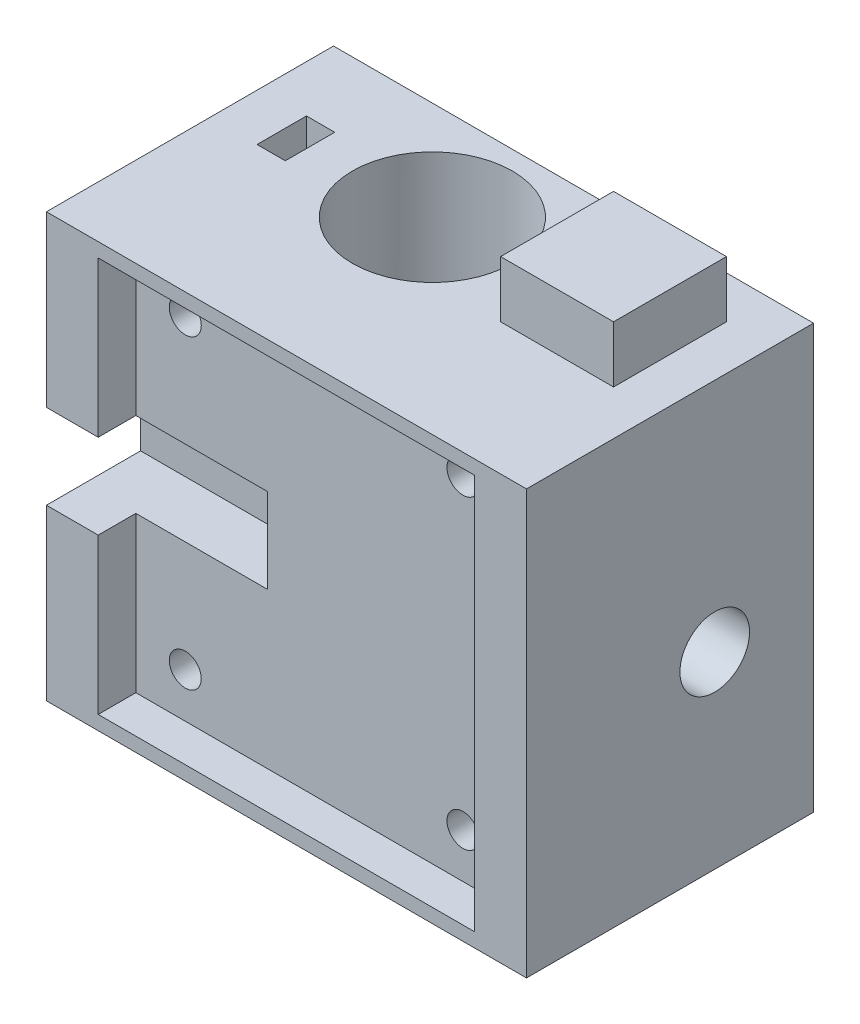
from build123d import *

# Parameters (mm, degrees)
BASE_R                        = 10.5
CUTLURE_TUBE_HOUSING_DEPTH    = 45
SKETCH1_W                     = 51
SKETCH1_H                     = 30.5
DETECTOR_LASER_HOUSING_DEPTH  = 45
CULTURE_SLOT_R                = 8.5
CULTURE_TUBE_SLOT_DEPTH       = 40
LASER_PORT_DEPTH              = 58.662812973
LASER_PORT_DEPTH_BACK         = 16
SKETCH3_R                     = 3.7
CUT_EXTRUDE3_REACH            = 59.663
CUT_EXTRUDE3_END_RADIUS       = 3.7
SKETCH4_W                     = 3
SKETCH4_H                     = 5.25
LED_DISPLAY_SCREW_HOLES_D     = 3.4
LED_DISPLAY_SCREW_HOLES_DEPTH = 20
SKETCH14_W                    = 40
SKETCH14_H                    = 42
CUT_EXTRUDE4_DEPTH            = 4
SKETCH16_W                    = 19.5
SKETCH16_H                    = 9
CUT_EXTRUDE6_DEPTH            = 10
SKETCH17_W                    = 12
SKETCH17_H                    = 12
BOSS_EXTRUDE3_DEPTH           = 6


with BuildPart() as part:
    # Base → Cutlure Tube Housing (new body)
    with BuildSketch(Plane(origin=(0, 0, 0), x_dir=(1, 0, 0), z_dir=(0, 1, 0))):
        with Locations(Location((0, 0, 0), (0, 0, 90))):
            Circle(BASE_R)
    extrude(amount=CUTLURE_TUBE_HOUSING_DEPTH)

    # Sketch1 → Detector+Laser Housing (add)
    with BuildSketch(Plane(origin=(0, 45, 0), x_dir=(1, 0, 0), z_dir=(0, 1, 0))):
        with Locations((4.5, -4.75)):
            Rectangle(SKETCH1_W, SKETCH1_H)
    extrude(amount=-DETECTOR_LASER_HOUSING_DEPTH)

    # Culture Slot → Culture Tube Slot (cut)
    with BuildSketch(Plane(origin=(0, 45, 0), x_dir=(1, 0, 0), z_dir=(0, 1, 0))):
        with Locations(Location((0, 0, 0), (0, 0, 270))):
            Circle(CULTURE_SLOT_R)
    extrude(amount=-CULTURE_TUBE_SLOT_DEPTH, mode=Mode.SUBTRACT)

    # Sketch3 → Laser Port (cut, two sides: drawn at the far end of the back side and taken through both)
    with BuildSketch(Plane(origin=(0, 0, 0), x_dir=(0, 0, -1), z_dir=(1, 0, 0)).offset(-LASER_PORT_DEPTH_BACK)):
        with Locations((0, 20)):
            Circle(SKETCH3_R)
    extrude(amount=LASER_PORT_DEPTH + LASER_PORT_DEPTH_BACK, mode=Mode.SUBTRACT)

    # Cut-Extrude3: up to this cylinder (the profile starts outside it)
    cut_extrude3_end = Plane(origin=(-14.5, 20, 0), z_dir=(1, 0, 0)) * Cylinder(CUT_EXTRUDE3_END_RADIUS, 127.726, mode=Mode.PRIVATE)
    # Sketch4 → Cut-Extrude3 (cut, up to the surface)
    with BuildSketch(Plane(origin=(0, 45, 0), x_dir=(1, 0, 0), z_dir=(0, 1, 0)), mode=Mode.PRIVATE) as cut_extrude3_sk1:
        with Locations((-14.5, 0)):
            Rectangle(SKETCH4_W, SKETCH4_H)
    cut_extrude3_tool1 = extrude(cut_extrude3_sk1.sketch, amount=-CUT_EXTRUDE3_REACH, mode=Mode.PRIVATE) - cut_extrude3_end
    add(cut_extrude3_tool1.solids().sort_by_distance((-14.5, 45, 0))[0], mode=Mode.SUBTRACT)

    # LED display Screw Holes
    with Locations(Plane.XY.offset(20)):
        with Locations((-10.25, 38.75), (-10.25, 6.25), (19.25, 38.75), (19.25, 6.25)):
            Hole(LED_DISPLAY_SCREW_HOLES_D / 2, depth=LED_DISPLAY_SCREW_HOLES_DEPTH)

    # Sketch14 → Cut-Extrude4 (cut)
    with BuildSketch(Plane.XY.offset(20)):
        with Locations((4.5, 22.5)):
            Rectangle(SKETCH14_W, SKETCH14_H)
    extrude(amount=-CUT_EXTRUDE4_DEPTH, mode=Mode.SUBTRACT)

    # Sketch16 → Cut-Extrude6 (cut)
    with BuildSketch(Plane.XY.offset(20)):
        with Locations((-11.25, 22.5)):
            Rectangle(SKETCH16_W, SKETCH16_H)
    extrude(amount=-CUT_EXTRUDE6_DEPTH, mode=Mode.SUBTRACT)

    # Sketch17 → Boss-Extrude3 (add)
    with BuildSketch(Plane(origin=(0, 45, 0), x_dir=(1, 0, 0), z_dir=(0, 1, 0))):
        with Locations((19.25, 0)):
            Rectangle(SKETCH17_W, SKETCH17_H)
    extrude(amount=BOSS_EXTRUDE3_DEPTH)


solid = part.part
